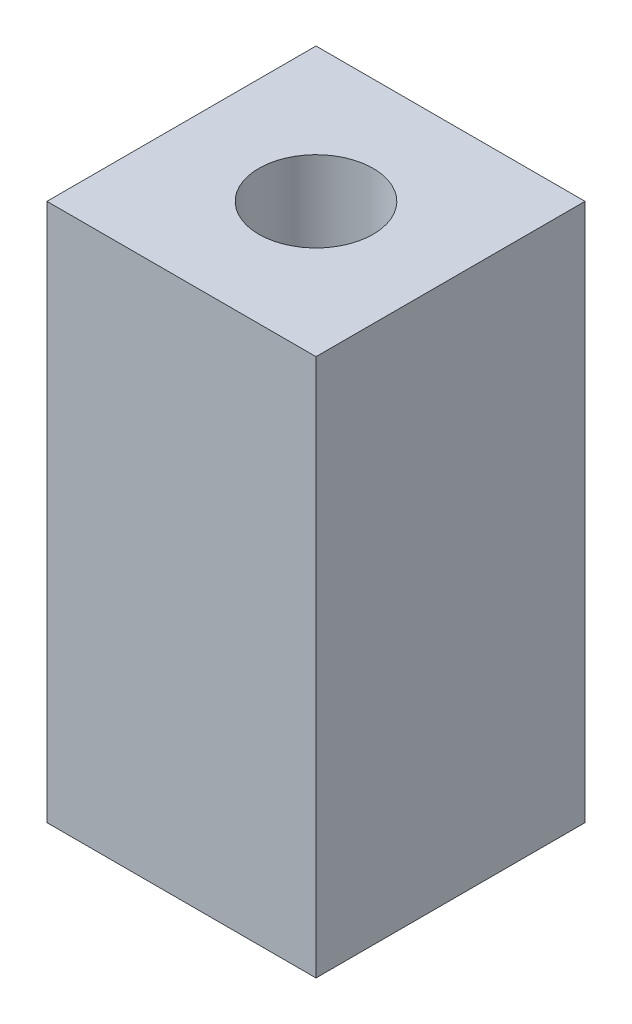
from build123d import *

# Parameters (mm, degrees)
SKETCH1_W           = 15.875
SKETCH1_H           = 15.875
SKETCH1_R           = 3.3734375
BOSS_EXTRUDE1_DEPTH = 31.75


with BuildPart() as part:
    # Sketch1 → Boss-Extrude1 (new body)
    with BuildSketch(Plane(origin=(0, 0, 0), x_dir=(1, 0, 0), z_dir=(0, 1, 0))):
        Rectangle(SKETCH1_W, SKETCH1_H)
        with Locations(Location((0, 0, 0), (0, 0, 270))):
            Circle(SKETCH1_R, mode=Mode.SUBTRACT)
    extrude(amount=BOSS_EXTRUDE1_DEPTH)


solid = part.part
